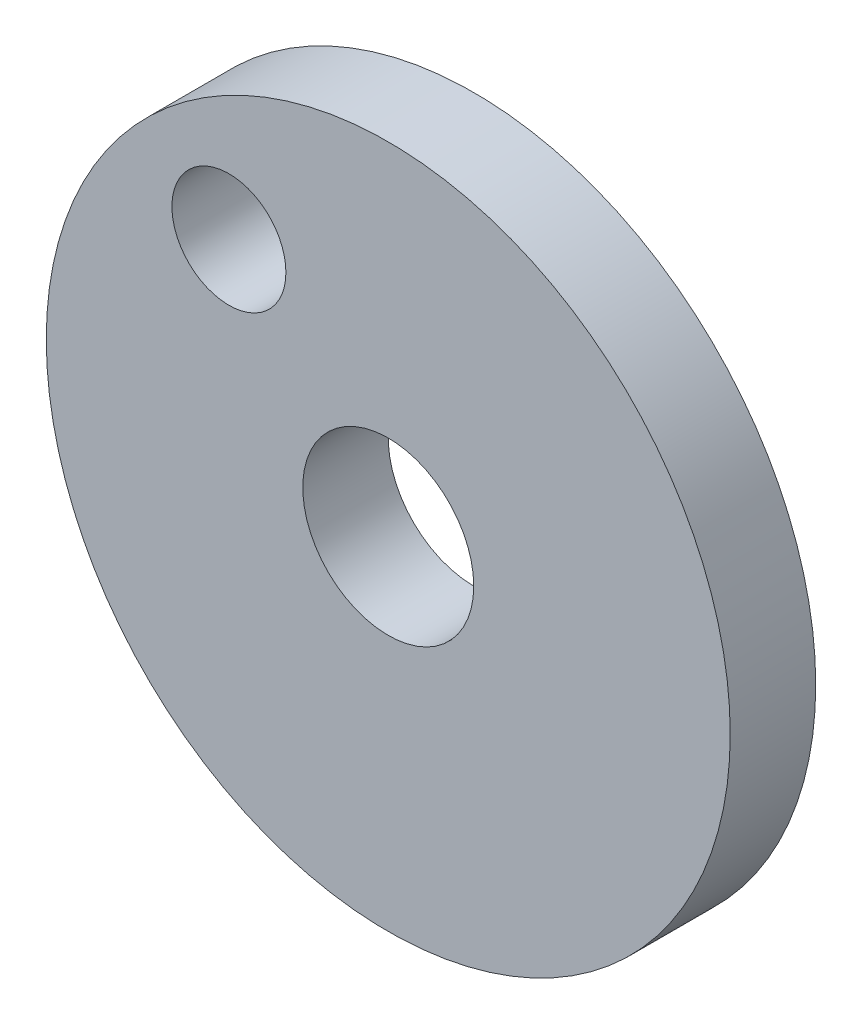
from build123d import *

# Parameters (mm, degrees)
SKETCH1_R           = 60
BOSS_EXTRUDE1_DEPTH = 15
SKETCH3_R           = 15
CUT_EXTRUDE1_DEPTH  = 15
SKETCH4_R           = 10
CUT_EXTRUDE2_DEPTH  = 15


with BuildPart() as part:
    # Sketch1 → Boss-Extrude1 (new body)
    with BuildSketch(Plane.XY):
        Circle(SKETCH1_R)
    extrude(amount=BOSS_EXTRUDE1_DEPTH)

    # Sketch3 → Cut-Extrude1 (cut)
    with BuildSketch(Plane.XY.offset(15)):
        Circle(SKETCH3_R)
    extrude(amount=-CUT_EXTRUDE1_DEPTH, mode=Mode.SUBTRACT)

    # Sketch4 → Cut-Extrude2 (cut)
    with BuildSketch(Plane.XY.offset(15)):
        with Locations((-27.955634388, 31.181284509)):
            Circle(SKETCH4_R)
    extrude(amount=-CUT_EXTRUDE2_DEPTH, mode=Mode.SUBTRACT)


solid = part.part
